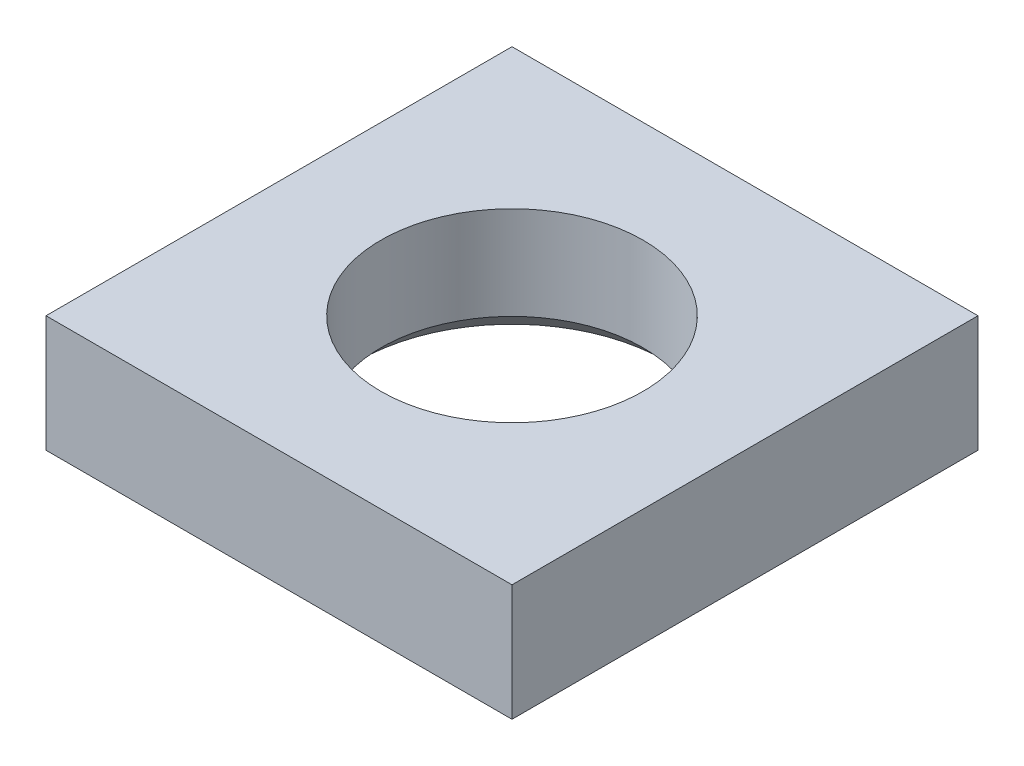
from build123d import *

# Parameters (mm, degrees)
SKETCH1_W           = 50.8
SKETCH1_H           = 50.8
BOSS_EXTRUDE1_DEPTH = 12.7
CUT_EXTRUDE1_REACH  = 40.1
SKETCH2_R           = 14.2875
CHAMFER1_SIZE       = 2.54


with BuildPart() as part:
    # Sketch1 → Boss-Extrude1 (new body)
    with BuildSketch(Plane(origin=(0, 0, 0), x_dir=(1, 0, 0), z_dir=(0, 1, 0))):
        Rectangle(SKETCH1_W, SKETCH1_H)
    extrude(amount=BOSS_EXTRUDE1_DEPTH)

    # Sketch2 → Cut-Extrude1 (cut, up to next)
    with BuildSketch(Plane(origin=(0, 12.7, 0), x_dir=(1, 0, 0), z_dir=(0, 1, 0)), mode=Mode.PRIVATE) as cut_extrude1_sk1:
        with Locations(Location((0, 0, 0), (0, 0, 270))):
            Circle(SKETCH2_R)
    cut_extrude1_tool1 = extrude(cut_extrude1_sk1.sketch, amount=-CUT_EXTRUDE1_REACH, mode=Mode.PRIVATE) & part.part
    add(cut_extrude1_tool1.solids().sort_by_distance((0, 12.7, 0))[0], mode=Mode.SUBTRACT)

    # Chamfer1
    chamfer1_edges = [part.edges().sort_by_distance(p)[0] for p in [
        (0, 0, -14.2875),
    ]]
    chamfer(chamfer1_edges, length=CHAMFER1_SIZE)


solid = part.part
